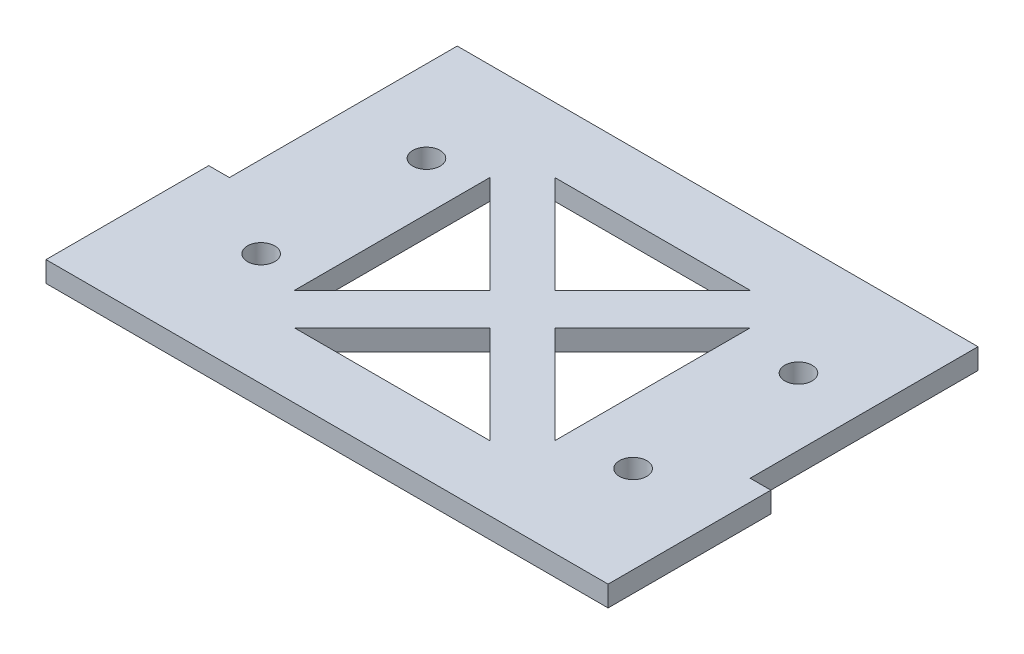
from build123d import *

# Parameters (mm, degrees)
BOSS_EXTRUDE1_DEPTH = 3.175
SKETCH2_R           = 2.1
CUT_EXTRUDE1_DEPTH  = 3.175
CUT_EXTRUDE2_DEPTH  = 3.175


with BuildPart() as part:
    # Sketch1 → Boss-Extrude1 (new body)
    with BuildSketch(Plane(origin=(0, 0, 0), x_dir=(1, 0, 0), z_dir=(0, 1, 0))):
        Polygon((-43.175, -5), (-43.175, -30), (43.175, -30), (43.175, -5), (40, -5), (40, 30), (-40, 30), (-40, -5), align=None)
    extrude(amount=BOSS_EXTRUDE1_DEPTH)

    # Sketch2 → Cut-Extrude1 (cut)
    with BuildSketch(Plane(origin=(0, 3.175, 0), x_dir=(1, 0, 0), z_dir=(0, 1, 0))):
        with Locations(Location((-27.43, 12.7, 0), (0, 0, 270))):
            Circle(SKETCH2_R)
        with Locations(Location((29.72, 12.7, 0), (0, 0, 270))):
            Circle(SKETCH2_R)
        with Locations(Location((29.72, -12.7, 0), (0, 0, 270))):
            Circle(SKETCH2_R)
        with Locations(Location((-27.43, -12.7, 0), (0, 0, 270))):
            Circle(SKETCH2_R)
    extrude(amount=-CUT_EXTRUDE1_DEPTH, mode=Mode.SUBTRACT)

    # Sketch3 → Cut-Extrude2 (cut)
    with BuildSketch(Plane(origin=(0, 3.175, 0), x_dir=(1, 0, 0), z_dir=(0, 1, 0))):
        Polygon((-20, -15), (-20, 15), (-5, 0), align=None)
        Polygon((0, 5), (-15, 20), (15, 20), align=None)
        Polygon((5, 0), (20, 15), (20, -15), align=None)
        Polygon((0, -5), (15, -20), (-15, -20), align=None)
    extrude(amount=-CUT_EXTRUDE2_DEPTH, mode=Mode.SUBTRACT)


solid = part.part
